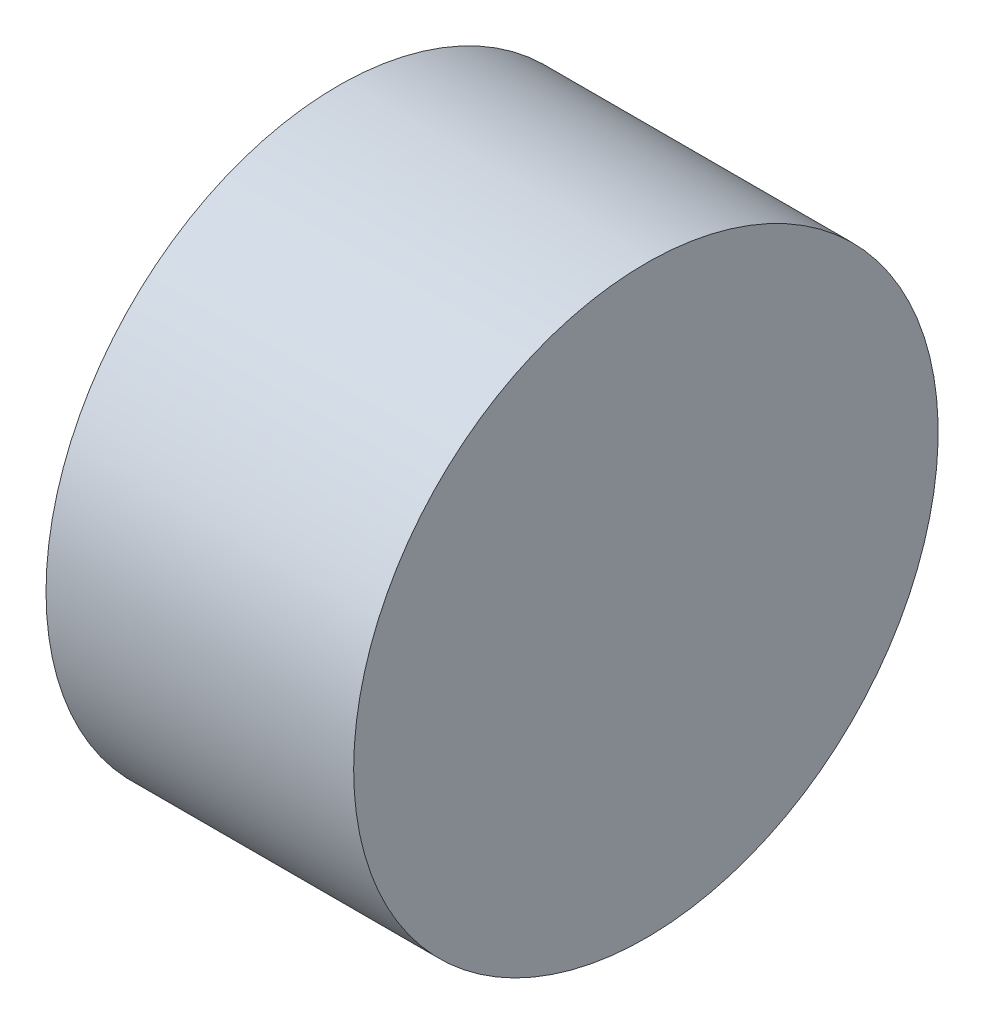
from build123d import *


with BuildPart() as part:
    # Esquisse1 → Base-Révolution (revolve)
    with BuildSketch(Plane.XY):
        Polygon((0, 0), (0, 4.75), (-5, 4.75), (-5, 4), (-0.75, 4), (-0.75, 0), align=None)
    revolve(axis=Axis((-124.153021442, 0, 0), (1, 0, 0)))


solid = part.part
